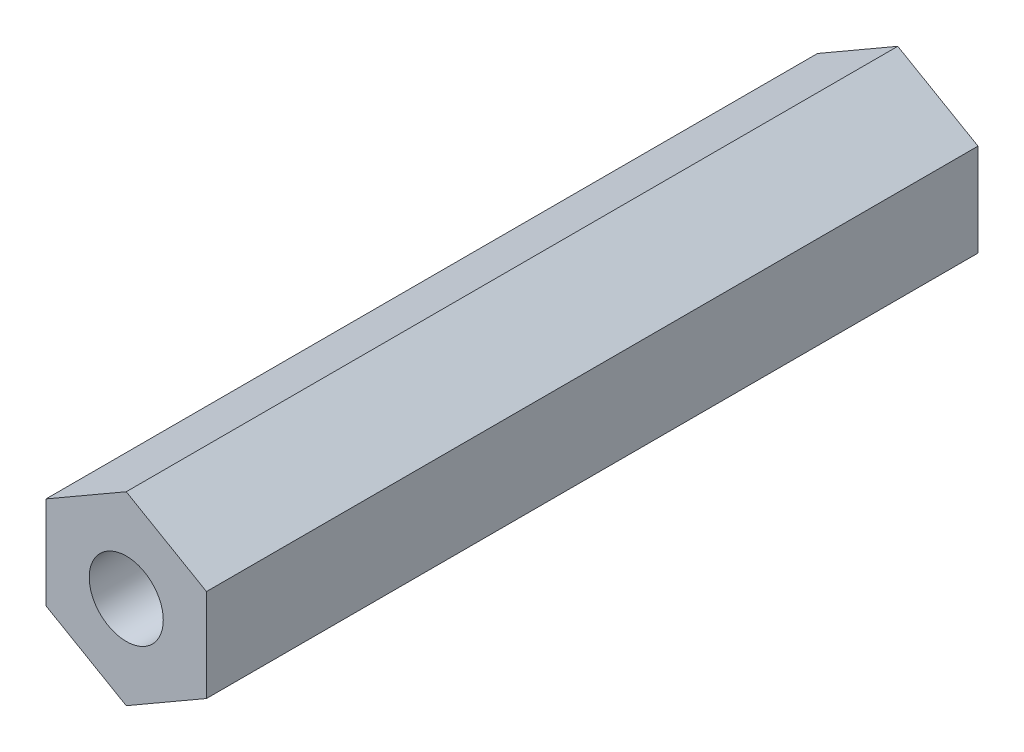
from build123d import *

# Parameters (mm, degrees)
SKETCH_1_R      = 1.2
EXTRUDE_1_DEPTH = 25


with BuildPart() as part:
    # 草图1 → 凸台-拉伸1 (new body)
    with BuildSketch(Plane.XY):
        Polygon((-2.6, 1.5011107), (-2.6, -1.5011107), (0, -3.0022214), (2.6, -1.5011107), (2.6, 1.5011107), (0, 3.0022214), align=None)
        Circle(SKETCH_1_R, mode=Mode.SUBTRACT)
    extrude(amount=EXTRUDE_1_DEPTH)


solid = part.part
